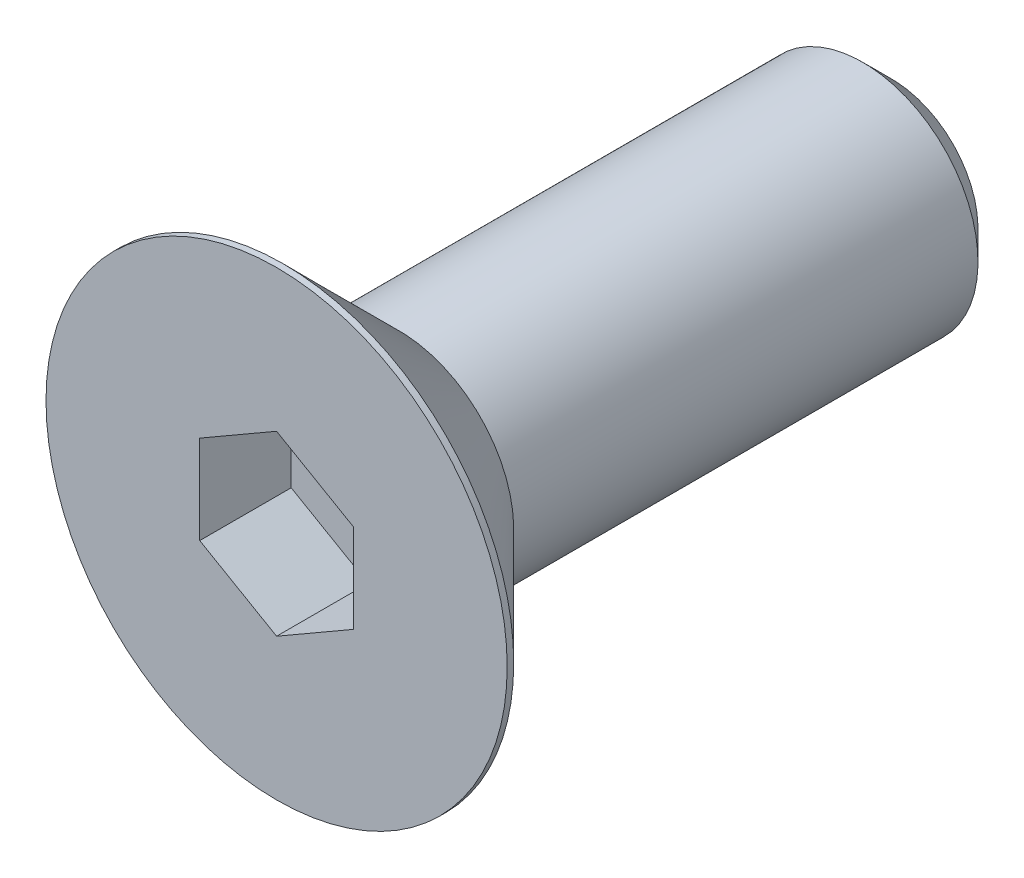
from build123d import *

# Parameters (mm, degrees)
CHAMFER1_SIZE      = 0.375
CUT_EXTRUDE2_DEPTH = 1.19


with BuildPart() as part:
    # Sketch1 → Revolve1 (revolve)
    with BuildSketch(Plane(origin=(0, 0, 0), x_dir=(0, 0, -1), z_dir=(1, 0, 0))):
        Polygon((-2.3, 1.5), (4, 1.5), (4, 0), (-2.81, 0), (-2.81, 1.5), align=None)
    revolve(axis=Axis((0, 0, 2.81), (0, 0, -1)))

    # Chamfer1
    chamfer1_edges = [part.edges().sort_by_distance(p)[0] for p in [
        (0, -1.5, -4),
    ]]
    chamfer(chamfer1_edges, length=CHAMFER1_SIZE)


with BuildPart() as body_2:
    # Sketch7 → Revolve2 (revolve)
    with BuildSketch(Plane(origin=(0, 0, 0), x_dir=(0, 0, -1), z_dir=(1, 0, 0))):
        Polygon((-3.915, 3), (-4, 3), (-4, 0), (-2.3, 0), (-2.3, 1.385), align=None)
    revolve(axis=Axis((0, 0, 4), (0, 0, -1)))

    # Sketch5 → Cut-Extrude2 (cut)
    with BuildSketch(Plane.XY.offset(4)):
        Polygon((1, -0.577350269), (1, 0.577350269), (0, 1.154700538), (-1, 0.577350269), (-1, -0.577350269), (0, -1.154700538), align=None)
    extrude(amount=-CUT_EXTRUDE2_DEPTH, mode=Mode.SUBTRACT)


solid = Compound([part.part, body_2.part])
